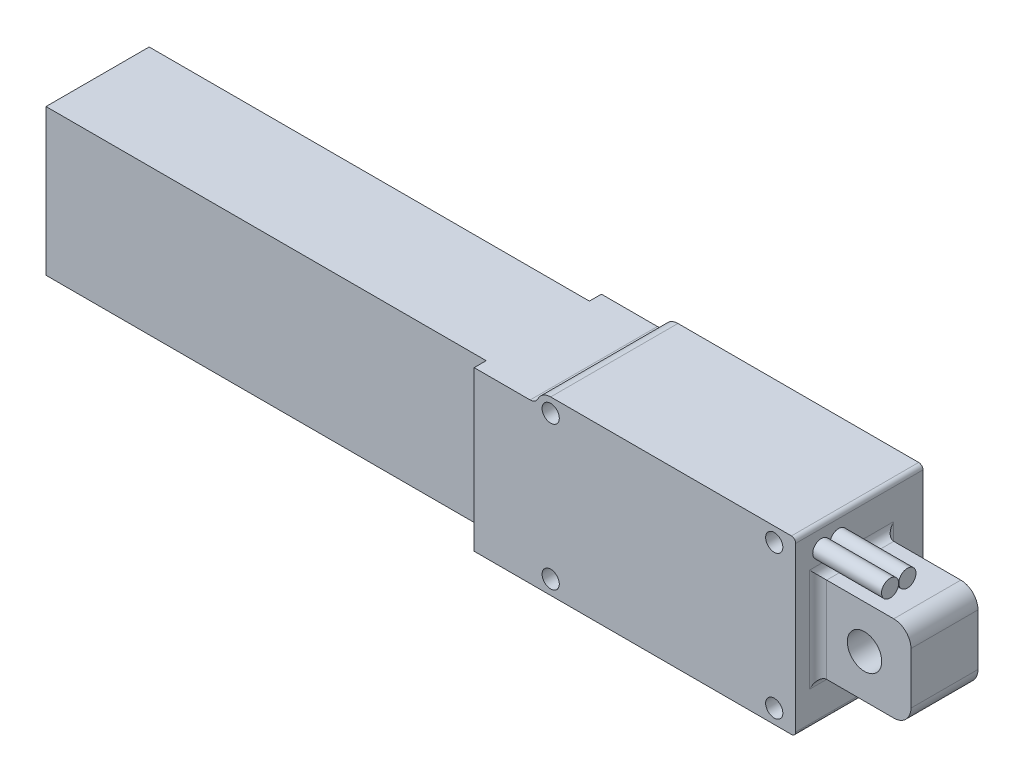
from build123d import *

# Parameters (mm, degrees)
BOSS_EXTRU_1_DEPTH      = 14.8
BOSS_EXTRU_2_START      = -2.6000000000000005
ESQUISSE2_R             = 2.000000000000003
BOSS_EXTRU_2_DEPTH      = 7.8
BOSS_EXTRU_3_START      = -1.4
BOSS_EXTRU_3_DEPTH      = 12
ENL_V_MAT_EXTRU_1_DEPTH = 50
CONG_1_R                = 1
CONG_2_R                = 1
ESQUISSE10_R            = 1.0000000000000018
ENL_V_MAT_EXTRU_2_DEPTH = 73.14603246194486
CONG_3_R                = 0.5
ESQUISSE11_R            = 1.0000000000000013
ESQUISSE11_R_2          = 0.9999999999999998
BOSS_EXTRU_5_DEPTH      = 8


with BuildPart() as part:
    # Esquisse1 → Boss.-Extru.1 (new body)
    with BuildSketch(Plane.XY):
        Polygon((-18.700000000000003, 10), (18.699999999999996, 10), (18.699999999999996, -10), (-18.7, -10), align=None)
    extrude(amount=BOSS_EXTRU_1_DEPTH)

    # Esquisse2 → Boss.-Extru.2 (add)
    with BuildSketch(Plane.XY.offset(14.8).offset(BOSS_EXTRU_2_START)):
        with BuildLine():
            Line((29.5, -3.0000000000000004), (29.5, 3.0000000000000004))
            ThreePointArc((29.5, 3.0000000000000004), (28.914213562373092, 4.414213562373096), (27.499999999999996, 4.999999999999998))
            Line((27.499999999999996, 5), (19.699999999999996, 5))
            ThreePointArc((19.699999999999996, 5.000000000000001), (18.99289321881345, 5.292893218813453), (18.699999999999996, 6))
            Line((18.699999999999996, 6), (18.699999999999996, 5))
            Line((18.699999999999996, 5.000000000000001), (18.699999999999996, -4.999999999999999))
            Line((18.699999999999996, -5), (18.699999999999996, -6))
            ThreePointArc((18.699999999999996, -6), (18.99289321881345, -5.292893218813453), (19.699999999999996, -5.000000000000001))
            Line((19.699999999999996, -5), (27.499999999999996, -5))
            ThreePointArc((27.499999999999996, -4.999999999999999), (28.914213562373096, -4.414213562373097), (29.5, -3.0000000000000004))
        make_face()
        with Locations((24.099999999999998, 0)):
            Circle(ESQUISSE2_R, mode=Mode.SUBTRACT)
    extrude(amount=-BOSS_EXTRU_2_DEPTH)

    # Esquisse4 → Boss.-Extru.3 (add)
    with BuildSketch(Plane.XY.offset(14.8).offset(BOSS_EXTRU_3_START)):
        Polygon((-69.9, 8.499999999999998), (-18.700000000000003, 8.499999999999998), (-18.700000000000003, -8.5), (-69.9, -8.499999999999998), align=None)
    extrude(amount=-BOSS_EXTRU_3_DEPTH)

    # Esquisse7 → Enlèv. mat.-Extru.1 (cut)
    with BuildSketch(Plane.ZY.offset(69.9)):
        Polygon((2.9000000000000026, 4.5), (11.9, 4.5), (11.900000000000004, -4.5), (2.9000000000000044, -4.5), align=None)
    extrude(amount=-ENL_V_MAT_EXTRU_1_DEPTH, mode=Mode.SUBTRACT)

    # Congé1
    cong_1_edges = [part.edges().sort_by_distance(p)[0] for p in [
        (18.699999999999996, 0, 4.4),
    ]]
    fillet(cong_1_edges, radius=CONG_1_R)

    # Congé2
    cong_2_edges = [part.edges().sort_by_distance(p)[0] for p in [
        (18.699999999999996, 0, 12.2),
    ]]
    fillet(cong_2_edges, radius=CONG_2_R)

    # Esquisse10 → Enlèv. mat.-Extru.2 (cut, through all)
    with BuildSketch(Plane.XY.offset(14.8)):
        with Locations((16.2, 8.35)):
            Circle(ESQUISSE10_R)
        with Locations((-9.800000000000002, 8.349999999999994)):
            Circle(ESQUISSE10_R)
        with Locations(Location((-9.80000000000001, -8.349999999999994, 0), (0, 0, 180))):
            Circle(ESQUISSE10_R)
        with Locations(Location((16.19999999999997, -8.35, 0), (0, 0, 180))):
            Circle(ESQUISSE10_R)
        with BuildLine():
            Line((-18.700000000000003, 8.499999999999998), (-12.187467277262673, 8.499999999999998))
            ThreePointArc((-12.187467277262673, 8.499999999999998), (-11.655472100663742, 8.653252616138984), (-11.286536229239028, 9.066037735849054))
            ThreePointArc((-11.286536229239028, 9.066037735849054), (-10.677792041388242, 9.747133183370671), (-9.800000000000002, 10))
            Line((-9.800000000000002, 10), (-18.700000000000003, 10))
            Line((-18.700000000000003, 10), (-18.700000000000003, 8.499999999999998))
        make_face()
    extrude(amount=-ENL_V_MAT_EXTRU_2_DEPTH, mode=Mode.SUBTRACT)

    # Congé3
    cong_3_edges = [part.edges().sort_by_distance(p)[0] for p in [
        (18.699999999999996, -10, 7.4),
        (18.699999999999996, 10, 7.4),
    ]]
    fillet(cong_3_edges, radius=CONG_3_R)

    # Esquisse11 → Boss.-Extru.5 (add)
    with BuildSketch(Plane(origin=(18.699999999999996, 0, 0), x_dir=(0, 0, -1), z_dir=(1, 0, 0))):
        with Locations(Location((-11.821599718382592, 7.5, 0), (0, 0, 180))):
            Circle(ESQUISSE11_R)
        with Locations(Location((-9.811599718382592, 7.5, 0), (0, 0, 180))):
            Circle(ESQUISSE11_R_2)
    extrude(amount=BOSS_EXTRU_5_DEPTH)


solid = part.part
